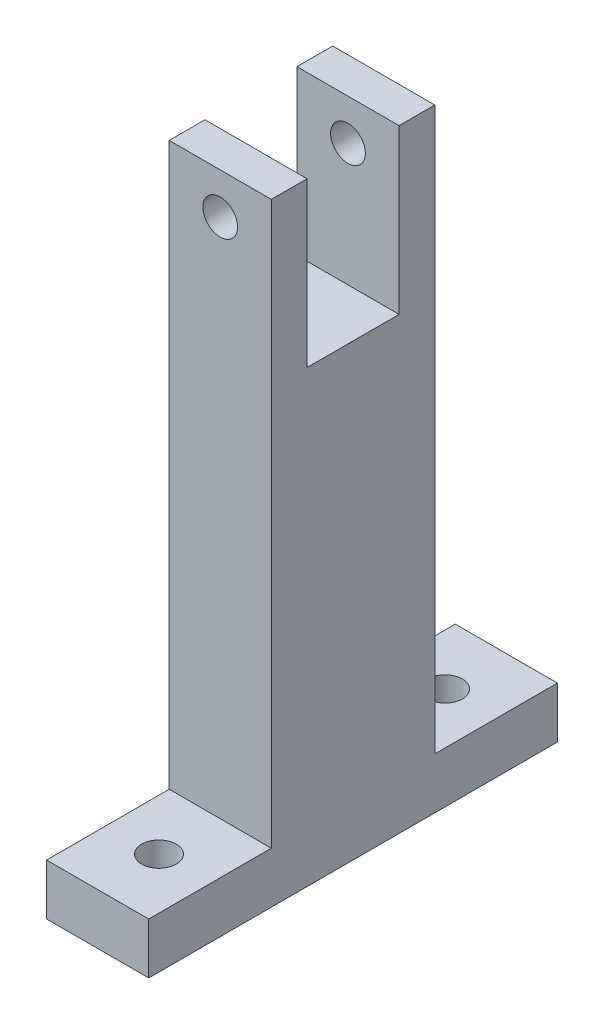
from build123d import *

# Parameters (mm, degrees)
IZIM1_W                          = 10
IZIM1_H                          = 60
Y_KSEKLIK_EKSTR_ZYON1_DEPTH      = 16
Y_KSEKLIK_EKSTR_ZYON2_DEPTH      = 12
Y_KSEKLIK_EKSTR_ZYON2_DEPTH_BACK = 28
IZIM2_W                          = 10
IZIM2_H                          = 5
IZIM3_W                          = 9
IZIM3_H                          = 16
KES_EKSTR_ZYON2_DEPTH            = 12
IZIM4_R                          = 1.7
KES_EKSTR_ZYON3_DEPTH            = 25
IZIM5_R                          = 1.7
KES_EKSTR_ZYON4_DEPTH            = 25


with BuildPart() as part:
    # Çizim1 → Yükseklik-Ekstrüzyon1 (new body)
    with BuildSketch(Plane.XY):
        with Locations((5, 30)):
            Rectangle(IZIM1_W, IZIM1_H)
    extrude(amount=Y_KSEKLIK_EKSTR_ZYON1_DEPTH)

    # Çizim2 → Yükseklik-Ekstrüzyon2 (add, two sides: drawn at the far end of the back side and taken through both)
    with BuildSketch(Plane.XY.offset(16).offset(-Y_KSEKLIK_EKSTR_ZYON2_DEPTH_BACK)):
        with Locations((5, 2.5)):
            Rectangle(IZIM2_W, IZIM2_H)
    extrude(amount=Y_KSEKLIK_EKSTR_ZYON2_DEPTH + Y_KSEKLIK_EKSTR_ZYON2_DEPTH_BACK)

    # Çizim3 → Kes-Ekstrüzyon2 (cut)
    with BuildSketch(Plane(origin=(10, 0, 0), x_dir=(0, 0, -1), z_dir=(1, 0, 0))):
        with Locations((-8, 52)):
            Rectangle(IZIM3_W, IZIM3_H)
    extrude(amount=-KES_EKSTR_ZYON2_DEPTH, mode=Mode.SUBTRACT)

    # Çizim4 → Kes-Ekstrüzyon3 (cut)
    with BuildSketch(Plane.XY.offset(16)):
        with Locations((5, 56)):
            Circle(IZIM4_R)
    extrude(amount=-KES_EKSTR_ZYON3_DEPTH, mode=Mode.SUBTRACT)

    # Çizim5 → Kes-Ekstrüzyon4 (cut)
    with BuildSketch(Plane(origin=(0, 5, 0), x_dir=(1, 0, 0), z_dir=(0, 1, 0))):
        with Locations(Location((5, 6, 0), (0, 0, 270))):
            Circle(IZIM5_R)
        with Locations(Location((5, -22, 0), (0, 0, 270))):
            Circle(IZIM5_R)
    extrude(amount=-KES_EKSTR_ZYON4_DEPTH, mode=Mode.SUBTRACT)


solid = part.part
